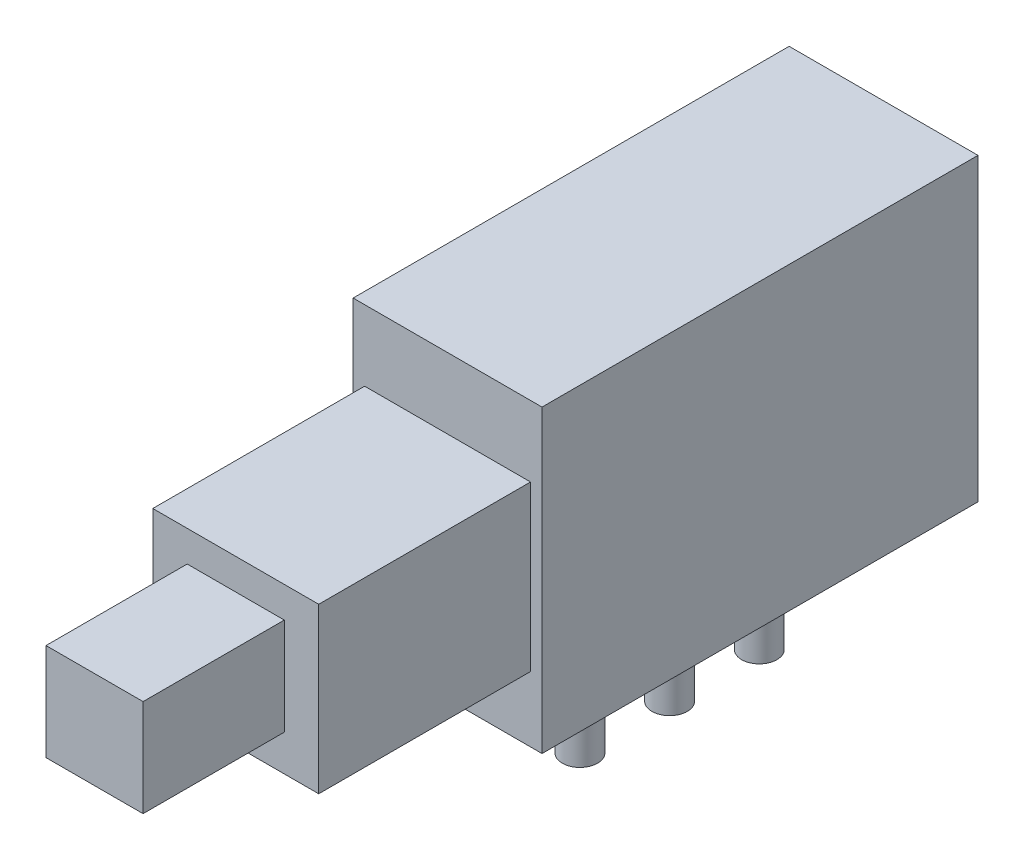
from build123d import *

# Parameters (mm, degrees)
SKETCH1_W           = 5.35
SKETCH1_H           = 8.5
BOSS_EXTRUDE1_DEPTH = 12.35
SKETCH2_W           = 2.75
SKETCH2_H           = 2.75
BOSS_EXTRUDE2_DEPTH = 10
SKETCH4_W           = 4.7
SKETCH4_H           = 4.65
BOSS_EXTRUDE4_DEPTH = 6
SKETCH3_R           = 0.5
BOSS_EXTRUDE3_DEPTH = 3.2


with BuildPart() as part:
    # Sketch1 → Boss-Extrude1 (new body)
    with BuildSketch(Plane.XY):
        Rectangle(SKETCH1_W, SKETCH1_H)
    extrude(amount=BOSS_EXTRUDE1_DEPTH)

    # Sketch2 → Boss-Extrude2 (add)
    with BuildSketch(Plane.XY.offset(12.35)):
        Rectangle(SKETCH2_W, SKETCH2_H)
    extrude(amount=BOSS_EXTRUDE2_DEPTH)

    # Sketch4 → Boss-Extrude4 (add)
    with BuildSketch(Plane.XY.offset(12.35)):
        with Locations((0, -0.075)):
            Rectangle(SKETCH4_W, SKETCH4_H)
    extrude(amount=BOSS_EXTRUDE4_DEPTH)

    # Sketch3 → Boss-Extrude3 (add)
    with BuildSketch(Plane.XZ.offset(4.25)):
        with Locations(Location((0, 8.6, 0), (0, 0, 90))):
            Circle(SKETCH3_R)
        with Locations(Location((0, 6.06, 0), (0, 0, 90))):
            Circle(SKETCH3_R)
        with Locations(Location((0, 3.52, 0), (0, 0, 90))):
            Circle(SKETCH3_R)
    extrude(amount=BOSS_EXTRUDE3_DEPTH)


solid = part.part
